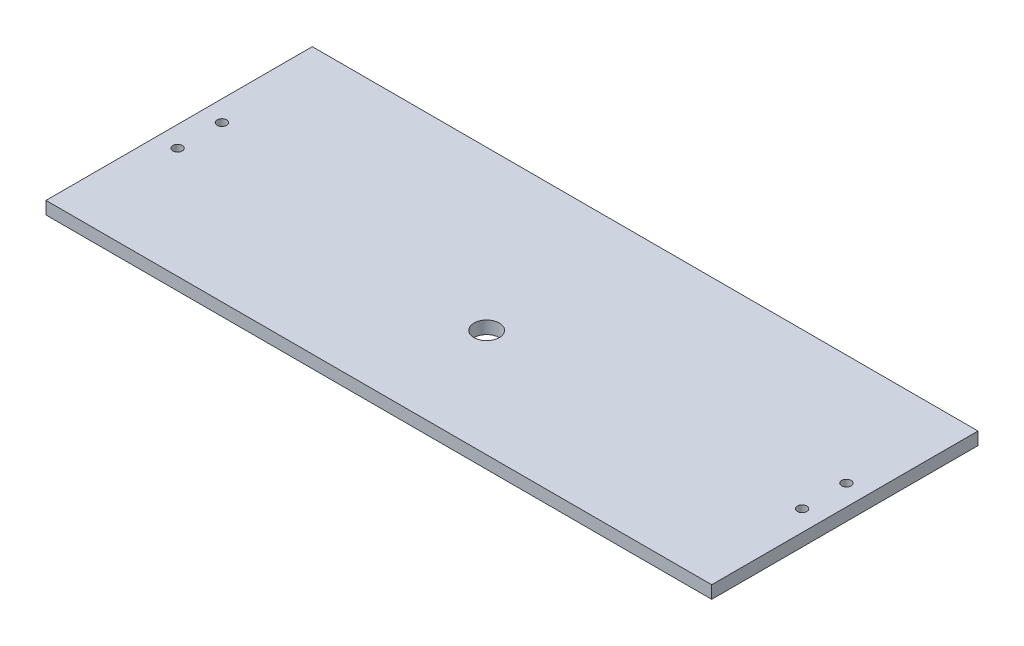
from build123d import *

# Parameters (mm, degrees)
CROQUIS2_W              = 210
CROQUIS2_H              = 84
CROQUIS2_R              = 4
CROQUIS2_R_2            = 1.5
SALIENTE_EXTRUIR1_DEPTH = 4


with BuildPart() as part:
    # Croquis2 → Saliente-Extruir1 (new body)
    with BuildSketch(Plane(origin=(-13.73192422, 703.628389678, -26.324312824), x_dir=(-1, 0, 0), z_dir=(0, -1, 0))):
        with Locations((-28.230309316, 14.115154658)):
            Rectangle(CROQUIS2_W, CROQUIS2_H)
        with Locations(Location((-28.230309316, 6.115154658, 0), (0, 0, 90))):
            Circle(CROQUIS2_R, mode=Mode.SUBTRACT)
        with Locations(Location((-126.730309316, 7.115154658, 0), (0, 0, 90))):
            Circle(CROQUIS2_R_2, mode=Mode.SUBTRACT)
        with Locations(Location((-126.730309316, 21.115154658, 0), (0, 0, 90))):
            Circle(CROQUIS2_R_2, mode=Mode.SUBTRACT)
        with Locations(Location((70.269690684, 21.115154658, 0), (0, 0, 90))):
            Circle(CROQUIS2_R_2, mode=Mode.SUBTRACT)
        with Locations(Location((70.269690684, 7.115154658, 0), (0, 0, 90))):
            Circle(CROQUIS2_R_2, mode=Mode.SUBTRACT)
    extrude(amount=-SALIENTE_EXTRUIR1_DEPTH)


solid = part.part
